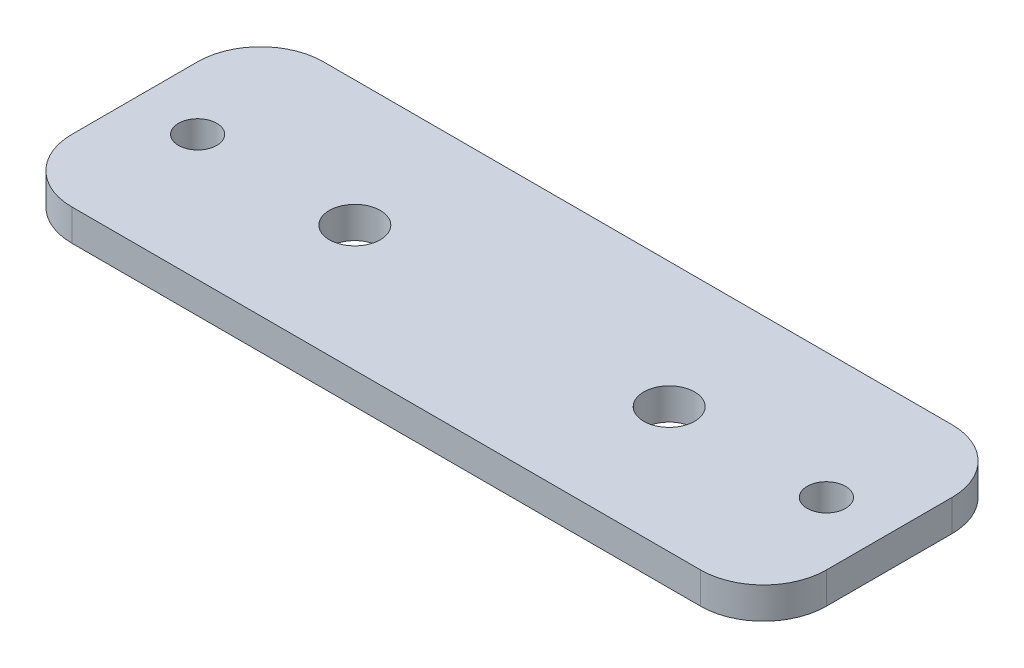
from build123d import *

# Parameters (mm, degrees)
SKETCH1_W           = 120
SKETCH1_H           = 40
BOSS_EXTRUDE1_DEPTH = 5
SKETCH2_R           = 4.05
SKETCH2_R_2         = 3.05
CUT_EXTRUDE1_DEPTH  = 64.442887702
FILLET1_R           = 10


with BuildPart() as part:
    # Sketch1 → Boss-Extrude1 (new body)
    with BuildSketch(Plane(origin=(0, 0, 0), x_dir=(1, 0, 0), z_dir=(0, 1, 0))):
        Rectangle(SKETCH1_W, SKETCH1_H)
    extrude(amount=BOSS_EXTRUDE1_DEPTH)

    # Sketch2 → Cut-Extrude1 (cut, through all)
    with BuildSketch(Plane(origin=(0, 5, 0), x_dir=(1, 0, 0), z_dir=(0, 1, 0))):
        with Locations(Location((-25, 0, 0), (0, 0, 270))):
            Circle(SKETCH2_R)
        with Locations(Location((-50, 0, 0), (0, 0, 270))):
            Circle(SKETCH2_R_2)
    cut_extrude1 = extrude(amount=-CUT_EXTRUDE1_DEPTH, mode=Mode.SUBTRACT)

    # Mirror1: Cut-Extrude1 across plane
    add(cut_extrude1.mirror(Plane(origin=(0, 0, 0), x_dir=(0, 0, 1), z_dir=(1, 0, 0))), mode=Mode.SUBTRACT)

    # Fillet1
    fillet1_edges = [part.edges().sort_by_distance(p)[0] for p in [
        (60, 2.5, 20),
        (-60, 2.5, 20),
        (-60, 2.5, -20),
        (60, 2.5, -20),
    ]]
    fillet(fillet1_edges, radius=FILLET1_R)


solid = part.part
